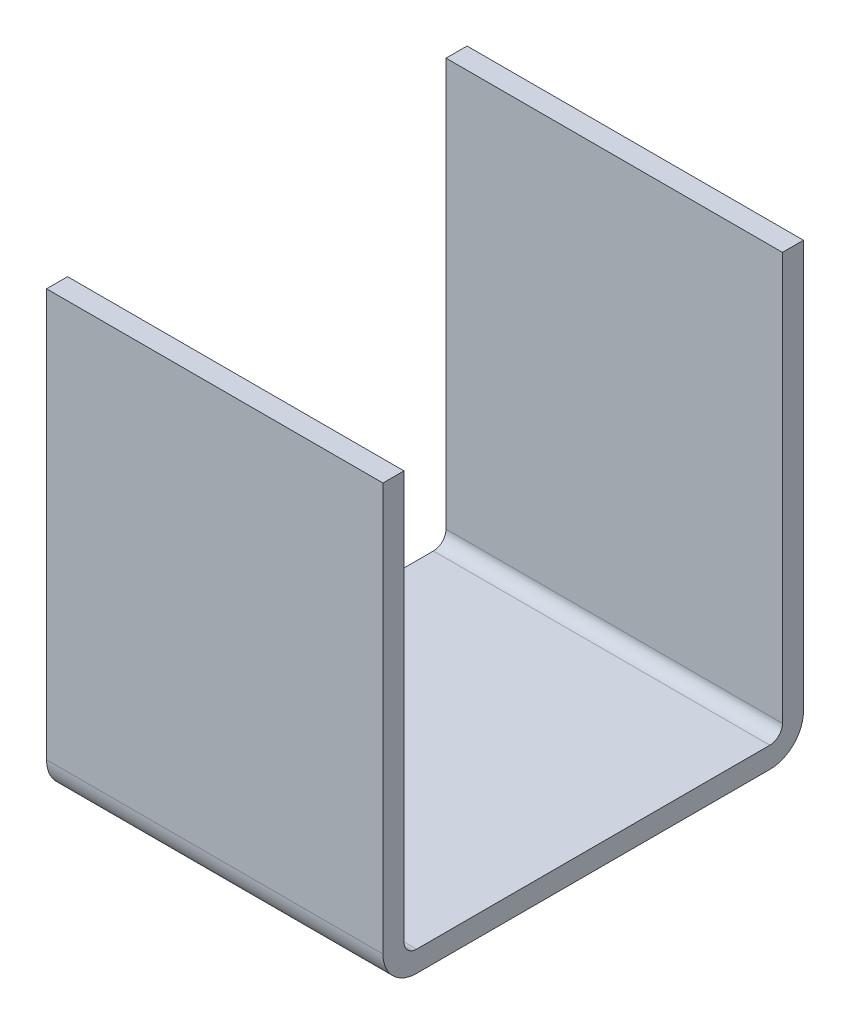
from build123d import *

# Parameters (mm, degrees)
SKETCH1_W           = 40
SKETCH1_H           = 50
BOSS_EXTRUDE1_DEPTH = 2.5
SKETCH2_W           = 40
SKETCH2_H           = 2.5
BOSS_EXTRUDE2_DEPTH = 50
FILLET1_R           = 4
FILLET2_R           = 1.5


with BuildPart() as part:
    # Sketch1 → Boss-Extrude1 (new body)
    with BuildSketch(Plane(origin=(0, 0, 0), x_dir=(1, 0, 0), z_dir=(0, 1, 0))):
        with Locations((20, 25)):
            Rectangle(SKETCH1_W, SKETCH1_H)
    extrude(amount=BOSS_EXTRUDE1_DEPTH)

    # Sketch2 → Boss-Extrude2 (add)
    with BuildSketch(Plane(origin=(0, 2.5, 0), x_dir=(1, 0, 0), z_dir=(0, 1, 0))):
        with Locations((20, 48.75)):
            Rectangle(SKETCH2_W, SKETCH2_H)
        with Locations((20, 1.25)):
            Rectangle(SKETCH2_W, SKETCH2_H)
    extrude(amount=BOSS_EXTRUDE2_DEPTH)

    # Fillet1
    fillet1_edges = [part.edges().sort_by_distance(p)[0] for p in [
        (20, 0, -50),
        (20, 0, 0),
    ]]
    fillet(fillet1_edges, radius=FILLET1_R)

    # Fillet2
    fillet2_edges = [part.edges().sort_by_distance(p)[0] for p in [
        (20, 2.5, -47.5),
        (20, 2.5, -2.5),
    ]]
    fillet(fillet2_edges, radius=FILLET2_R)


solid = part.part
